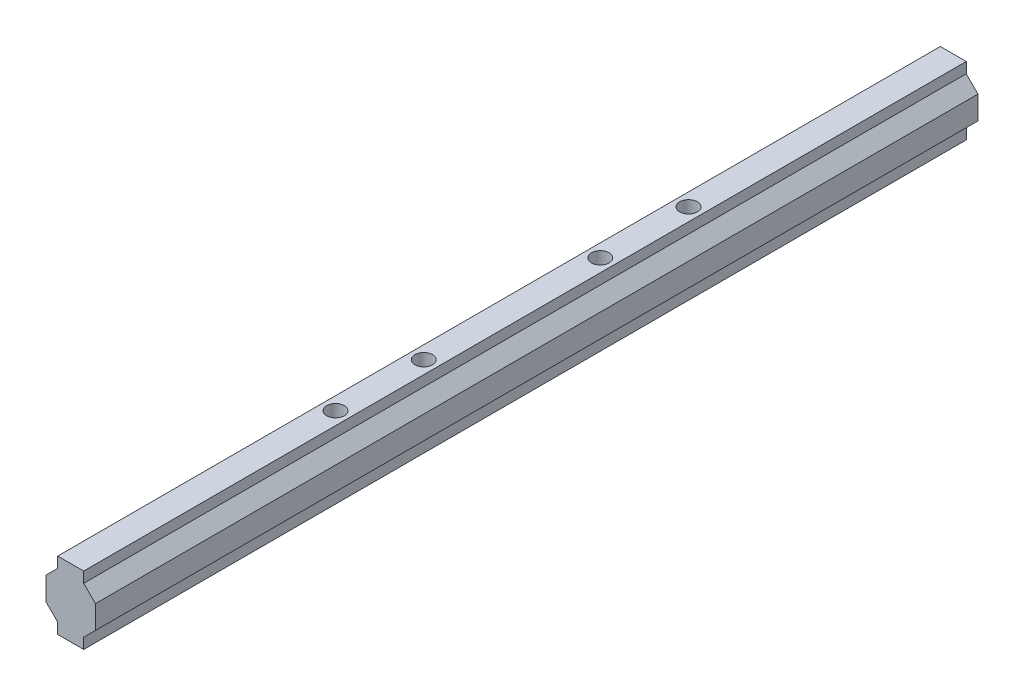
from build123d import *

# Parameters (mm, degrees)
BOSS_EXTRUDE1_DEPTH = 200
SKETCH4_R           = 2
CUT_EXTRUDE1_DEPTH  = 40


with BuildPart() as part:
    # Sketch1 → Boss-Extrude1 (new body)
    with BuildSketch(Plane.XY.offset(116.106580091)):
        Polygon((-39.550290087, 5.294235639), (-36.889629915, 7.954895811), (-36.889629915, 10.362002592), (-31.010950259, 10.362002592), (-31.010950259, 7.954895811), (-28.350290087, 5.294235639), (-28.350290087, 0.029769545), (-31.010950259, -2.630890626), (-31.010950259, -5.037997408), (-36.889629915, -5.037997408), (-36.889629915, -2.630890626), (-39.550290087, 0.029769545), align=None)
    extrude(amount=BOSS_EXTRUDE1_DEPTH)

    # Sketch4 → Cut-Extrude1 (cut)
    with BuildSketch(Plane(origin=(0, -5.037997408, 0), x_dir=(-1, 0, 0), z_dir=(0, -1, 0))):
        with Locations(Location((33.950290087, -176.106580091, 0), (0, 0, 180))):
            Circle(SKETCH4_R)
        with Locations(Location((33.950290087, -196.106580091, 0), (0, 0, 180))):
            Circle(SKETCH4_R)
        with Locations(Location((33.950290087, -236.106580091, 0), (0, 0, 90))):
            Circle(SKETCH4_R)
        with Locations(Location((33.950290087, -256.106580091, 0), (0, 0, 90))):
            Circle(SKETCH4_R)
    extrude(amount=-CUT_EXTRUDE1_DEPTH, mode=Mode.SUBTRACT)


solid = part.part
